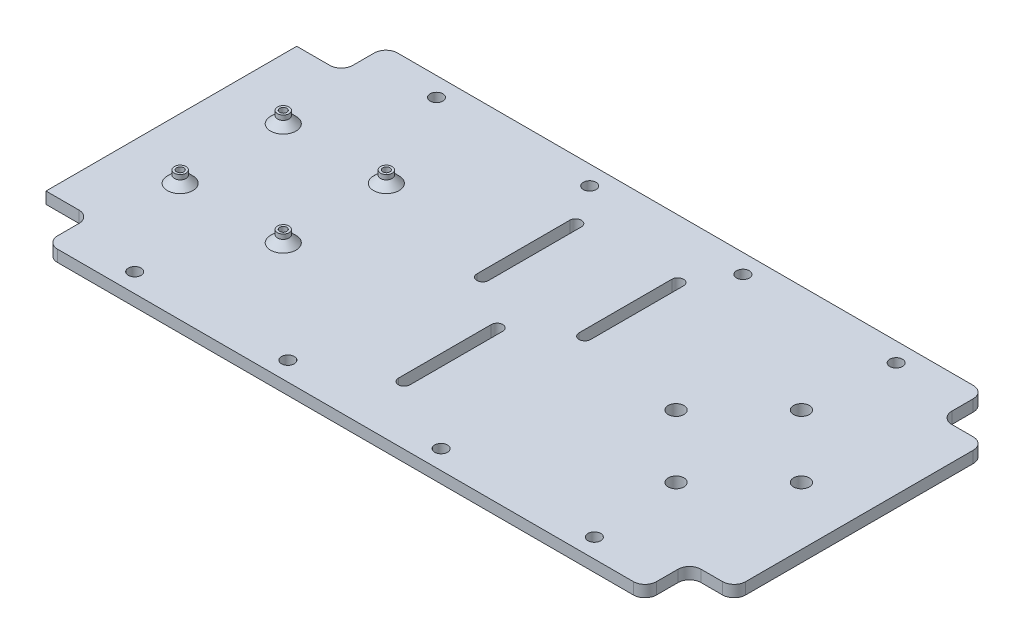
from build123d import *

# Parameters (mm, degrees)
SKIZZE1_W                            = 258
SKIZZE1_H                            = 146.4
SKIZZE1_W_2                          = 19.2
SKIZZE1_H_2                          = 108
AUFSATZ_LINEAR_AUSTRAGEN1_DEPTH      = 5
AUFSATZ_LINEAR_AUSTRAGEN2_DEPTH      = 2
VERRUNDUNG1_R                        = 5
LINEARES_MUSTER1_COUNT               = 5
LINEARES_MUSTER1_PITCH               = 49
VERRUNDUNG1_OF_LINEARES_MUSTER1_R    = 5
VERRUNDUNG2_R                        = 5
SCHNITT_LINEAR_AUSTRAGEN1_DEPTH      = 166.802533153
SCHNITT_LINEAR_AUSTRAGEN1_DEPTH_BACK = 166.802533153
SCHNITT_LINEAR_AUSTRAGEN5_REACH      = 167.486
SKIZZE4_W                            = 24.001061194
SKIZZE4_H                            = 45
SCHNITT_LINEAR_START                 = -8
SCHNITT_LINEAR_AUSTRAGEN6_DEPTH      = 8
SKIZZE6_W                            = 45.160438248
SKIZZE6_H                            = 56.831113301
SCHNITT_LINEAR_AUSTRAGEN7_DEPTH      = 166.485588501
SCHNITT_LINEAR_AUSTRAGEN8_DEPTH      = 166.971322833
SCHNITT_LINEAR_AUSTRAGEN8_DEPTH_BACK = 166.971322833
SKIZZE7_R                            = 3.4
SKIZZE8_R                            = 10
SCHNITT_LINEAR_AUSTRAGEN9_DEPTH      = 20
SKIZZE10_R                           = 2.5
SKIZZE10_R_2                         = 1.55
AUFSATZ_LINEAR_AUSTRAGEN3_DEPTH      = 5
SKIZZE11_R                           = 1.55
SCHNITT_LINEAR_AUSTRAGEN10_DEPTH     = 167.269299642
SKIZZE12_R                           = 3.4
SCHNITT_LINEAR_AUSTRAGEN11_DEPTH     = 166.802533161
SKIZZE16_R                           = 2.75
SCHNITT_LINEAR_AUSTRAGEN14_DEPTH     = 166.802533161
FASE2_SIZE                           = 3


with BuildPart() as part:
    # Skizze1 → Aufsatz-Linear austragen1 (new body)
    with BuildSketch(Plane(origin=(0, 20, 0), x_dir=(1, 0, 0), z_dir=(0, 1, 0))):
        Rectangle(SKIZZE1_W, SKIZZE1_H)
        with Locations((138.6, 0)):
            Rectangle(SKIZZE1_W_2, SKIZZE1_H_2)
        with Locations((-138.6, 0)):
            Rectangle(SKIZZE1_W_2, SKIZZE1_H_2)
    extrude(amount=AUFSATZ_LINEAR_AUSTRAGEN1_DEPTH)

    # Skizze2 → Aufsatz-Linear austragen2 (add)
    with BuildSketch(Plane.YZ.offset(-97)):
        Polygon((20, 52), (14, 52), (12, 50), (12, -50), (14, -52), (20, -52), align=None)
    aufsatz_linear_austragen2 = extrude(amount=-AUFSATZ_LINEAR_AUSTRAGEN2_DEPTH)

    # Verrundung1
    verrundung1_edges = [part.edges().sort_by_distance(p)[0] for p in [
        (-99, 20, 0),
        (-98, 20, 52),
        (-98, 20, -52),
        (-97, 20, 0),
    ]]
    fillet(verrundung1_edges, radius=VERRUNDUNG1_R)

    # Lineares Muster1: Aufsatz-Linear austragen2 ×5
    with Locations(*[(i * LINEARES_MUSTER1_PITCH, 0, 0) for i in range(1, LINEARES_MUSTER1_COUNT)]):
        add(aufsatz_linear_austragen2)

    # Verrundung1 of Lineares Muster1
    verrundung1_of_lineares_muster1_edges = [part.edges().sort_by_distance(p)[0] for p in [
        (-50, 20, 0),
        (-49, 20, 52),
        (-49, 20, -52),
        (-48, 20, 0),
        (-1, 20, 0),
        (0, 20, 52),
        (0, 20, -52),
        (1, 20, 0),
        (48, 20, 0),
        (49, 20, 52),
        (49, 20, -52),
        (50, 20, 0),
        (97, 20, 0),
        (98, 20, 52),
        (98, 20, -52),
        (99, 20, 0),
    ]]
    fillet(verrundung1_of_lineares_muster1_edges, radius=VERRUNDUNG1_OF_LINEARES_MUSTER1_R)

    # Verrundung2
    verrundung2_edges = [part.edges().sort_by_distance(p)[0] for p in [
        (-129, 22.5, -54),
        (-129, 22.5, -73.2),
        (129, 22.5, -73.2),
        (129, 22.5, -54),
        (148.2, 22.5, -54),
        (148.2, 22.5, 54),
        (129, 22.5, 54),
        (129, 22.5, 73.2),
        (-129, 22.5, 73.2),
        (-129, 22.5, 54),
    ]]
    fillet(verrundung2_edges, radius=VERRUNDUNG2_R)

    # Skizze3 → Schnitt-Linear austragen1 (cut, two sides: drawn at the far end of the back side and taken through both)
    with BuildSketch(Plane(origin=(0, 25, 0), x_dir=(-1, 0, 0), z_dir=(0, 1, 0)).offset(-SCHNITT_LINEAR_AUSTRAGEN1_DEPTH_BACK)):
        with BuildLine():
            Line((-2.5, 7.910571474), (-2.5, 47.910571474))
            ThreePointArc((-2.5, 47.910571474), (0, 50.410571474), (2.5, 47.910571474))
            Line((2.5, 47.910571474), (2.5, 7.910571474))
            ThreePointArc((2.5, 7.910571474), (0, 5.410571474), (-2.5, 7.910571474))
        make_face()
        with BuildLine():
            Line((-24.5, -47.910571474), (-24.5, -7.910571474))
            ThreePointArc((-24.5, -7.910571474), (-22, -5.410571474), (-19.5, -7.910571474))
            Line((-19.5, -7.910571474), (-19.5, -47.910571474))
            ThreePointArc((-19.5, -47.910571474), (-22, -50.410571474), (-24.5, -47.910571474))
        make_face()
        with BuildLine():
            Line((19.5, -47.910571474), (19.5, -7.910571474))
            ThreePointArc((19.5, -7.910571474), (22, -5.410571474), (24.5, -7.910571474))
            Line((24.5, -7.910571474), (24.5, -47.910571474))
            ThreePointArc((24.5, -47.910571474), (22, -50.410571474), (19.5, -47.910571474))
        make_face()
    extrude(amount=SCHNITT_LINEAR_AUSTRAGEN1_DEPTH + SCHNITT_LINEAR_AUSTRAGEN1_DEPTH_BACK, mode=Mode.SUBTRACT)

    # Schnitt-Linear austragen5: up to this face of the body (flat: up to its plane)
    schnitt_linear_austragen5_end = Plane(part.part.faces().sort_by_distance((0, 12, -22.260496848))[0])
    # Skizze4 → Schnitt-Linear austragen5 (cut, up to the picked face)
    with BuildSketch(Plane.XZ.offset(-20), mode=Mode.PRIVATE) as schnitt_linear_austragen5_sk1:
        with Locations((-1.454722971, 27.910571474)):
            Rectangle(SKIZZE4_W, SKIZZE4_H)
    schnitt_linear_austragen5_tool1 = split(extrude(schnitt_linear_austragen5_sk1.sketch, amount=SCHNITT_LINEAR_AUSTRAGEN5_REACH, mode=Mode.PRIVATE), bisect_by=schnitt_linear_austragen5_end, keep=Keep.BOTH, mode=Mode.PRIVATE)
    add(schnitt_linear_austragen5_tool1.solids().sort_by(Axis((-1.454723, 20, 27.910571), (0, -1, 0)))[0], mode=Mode.SUBTRACT)

    # Skizze5 → Schnitt-Linear austragen6 (cut)
    with BuildSketch(Plane.XZ.offset(-12).offset(SCHNITT_LINEAR_START)):
        with BuildLine():
            Line((6.476845444, 47.910571474), (6.476845444, 7.910571474))
            ThreePointArc((6.476845444, 7.910571474), (0, 1.43372603), (-6.476845444, 7.910571474))
            Line((-6.476845444, 7.910571474), (-6.476845444, 47.910571474))
            ThreePointArc((-6.476845444, 47.910571474), (0, 54.387416918), (6.476845444, 47.910571474))
        make_face()
    extrude(amount=SCHNITT_LINEAR_AUSTRAGEN6_DEPTH, mode=Mode.SUBTRACT)

    # Skizze6 → Schnitt-Linear austragen7 (cut, through all)
    with BuildSketch(Plane.XZ.offset(-20)):
        with Locations((-5.666197308, 64.104142682)):
            Rectangle(SKIZZE6_W, SKIZZE6_H)
    extrude(amount=SCHNITT_LINEAR_AUSTRAGEN7_DEPTH, mode=Mode.SUBTRACT)

    # Skizze7 → Schnitt-Linear austragen8 (cut, two sides: drawn at the far end of the back side and taken through both)
    with BuildSketch(Plane(origin=(0, 27, 0), x_dir=(1, 0, 0), z_dir=(0, 1, 0)).offset(-SCHNITT_LINEAR_AUSTRAGEN8_DEPTH_BACK)):
        with Locations(Location((96.200893633, -27, 0), (0, 0, 270))):
            Circle(SKIZZE7_R)
        with Locations(Location((96.200893633, 27, 0), (0, 0, 270))):
            Circle(SKIZZE7_R)
    extrude(amount=SCHNITT_LINEAR_AUSTRAGEN8_DEPTH + SCHNITT_LINEAR_AUSTRAGEN8_DEPTH_BACK, mode=Mode.SUBTRACT)

    # Skizze8 → Schnitt-Linear austragen9 (cut)
    with BuildSketch(Plane.XZ.offset(-20)):
        with Locations((96.200893633, 27)):
            Circle(SKIZZE8_R)
        with Locations((96.200893633, -27)):
            Circle(SKIZZE8_R)
    extrude(amount=SCHNITT_LINEAR_AUSTRAGEN9_DEPTH, mode=Mode.SUBTRACT)

    # Skizze10 → Aufsatz-Linear austragen3 (add)
    # profile 1 of 4: a face of its own
    with BuildSketch(Plane(origin=(0, 25, 0), x_dir=(-1, 0, 0), z_dir=(0, 1, 0))):
        with Locations(Location((77.8, 22.2, 0), (0, 0, 90))):
            Circle(SKIZZE10_R)
        with Locations(Location((77.8, 22.2, 0), (0, 0, 90))):
            Circle(SKIZZE10_R_2, mode=Mode.SUBTRACT)
    # profile 2 of 4: a face of its own
    with BuildSketch(Plane(origin=(0, 25, 0), x_dir=(-1, 0, 0), z_dir=(0, 1, 0))):
        with Locations(Location((122.2, 22.2, 0), (0, 0, 90))):
            Circle(SKIZZE10_R)
        with Locations(Location((122.2, 22.2, 0), (0, 0, 90))):
            Circle(SKIZZE10_R_2, mode=Mode.SUBTRACT)
    # profile 3 of 4: a face of its own
    with BuildSketch(Plane(origin=(0, 25, 0), x_dir=(-1, 0, 0), z_dir=(0, 1, 0))):
        with Locations(Location((122.2, -22.2, 0), (0, 0, 90))):
            Circle(SKIZZE10_R)
        with Locations(Location((122.2, -22.2, 0), (0, 0, 90))):
            Circle(SKIZZE10_R_2, mode=Mode.SUBTRACT)
    # profile 4 of 4: a face of its own
    with BuildSketch(Plane(origin=(0, 25, 0), x_dir=(-1, 0, 0), z_dir=(0, 1, 0))):
        with Locations(Location((77.8, -22.2, 0), (0, 0, 90))):
            Circle(SKIZZE10_R)
        with Locations(Location((77.8, -22.2, 0), (0, 0, 90))):
            Circle(SKIZZE10_R_2, mode=Mode.SUBTRACT)
    extrude(amount=AUFSATZ_LINEAR_AUSTRAGEN3_DEPTH)

    # Skizze11 → Schnitt-Linear austragen10 (cut, through all)
    with BuildSketch(Plane(origin=(0, 30, 0), x_dir=(-1, 0, 0), z_dir=(0, 1, 0))):
        with Locations(Location((122.2, -22.2, 0), (0, 0, 90))):
            Circle(SKIZZE11_R)
        with Locations(Location((77.8, -22.2, 0), (0, 0, 90))):
            Circle(SKIZZE11_R)
        with Locations(Location((122.2, 22.2, 0), (0, 0, 90))):
            Circle(SKIZZE11_R)
        with Locations(Location((77.8, 22.2, 0), (0, 0, 90))):
            Circle(SKIZZE11_R)
    extrude(amount=-SCHNITT_LINEAR_AUSTRAGEN10_DEPTH, mode=Mode.SUBTRACT)

    # Skizze12 → Schnitt-Linear austragen11 (cut, through all)
    with BuildSketch(Plane(origin=(0, 25, 0), x_dir=(-1, 0, 0), z_dir=(0, 1, 0))):
        with Locations(Location((-123.200893633, 0, 0), (0, 0, 90))):
            Circle(SKIZZE12_R)
        with Locations(Location((-69.200893633, 0, 0), (0, 0, 90))):
            Circle(SKIZZE12_R)
    extrude(amount=-SCHNITT_LINEAR_AUSTRAGEN11_DEPTH, mode=Mode.SUBTRACT)

    # Skizze16 → Schnitt-Linear austragen14 (cut, through all)
    with BuildSketch(Plane(origin=(0, 25, 0), x_dir=(1, 0, 0), z_dir=(0, 1, 0))):
        with Locations(Location((-99, 65, 0), (0, 0, 270))):
            Circle(SKIZZE16_R)
        with Locations(Location((-33, 65, 0), (0, 0, 270))):
            Circle(SKIZZE16_R)
        with Locations(Location((33, 65, 0), (0, 0, 270))):
            Circle(SKIZZE16_R)
        with Locations(Location((99, 65, 0), (0, 0, 270))):
            Circle(SKIZZE16_R)
    schnitt_linear_austragen14 = extrude(amount=-SCHNITT_LINEAR_AUSTRAGEN14_DEPTH, mode=Mode.SUBTRACT)

    # Spiegeln1: Schnitt-Linear austragen14 across plane
    add(schnitt_linear_austragen14.mirror(Plane.XY), mode=Mode.SUBTRACT)

    # Fase2
    fase2_edges = [part.edges().sort_by_distance(p)[0] for p in [
        (-77.8, 25, -24.7),
        (-122.2, 25, -24.7),
        (-122.2, 25, 19.7),
        (-77.8, 25, 19.7),
    ]]
    chamfer(fase2_edges, length=FASE2_SIZE)


solid = part.part
